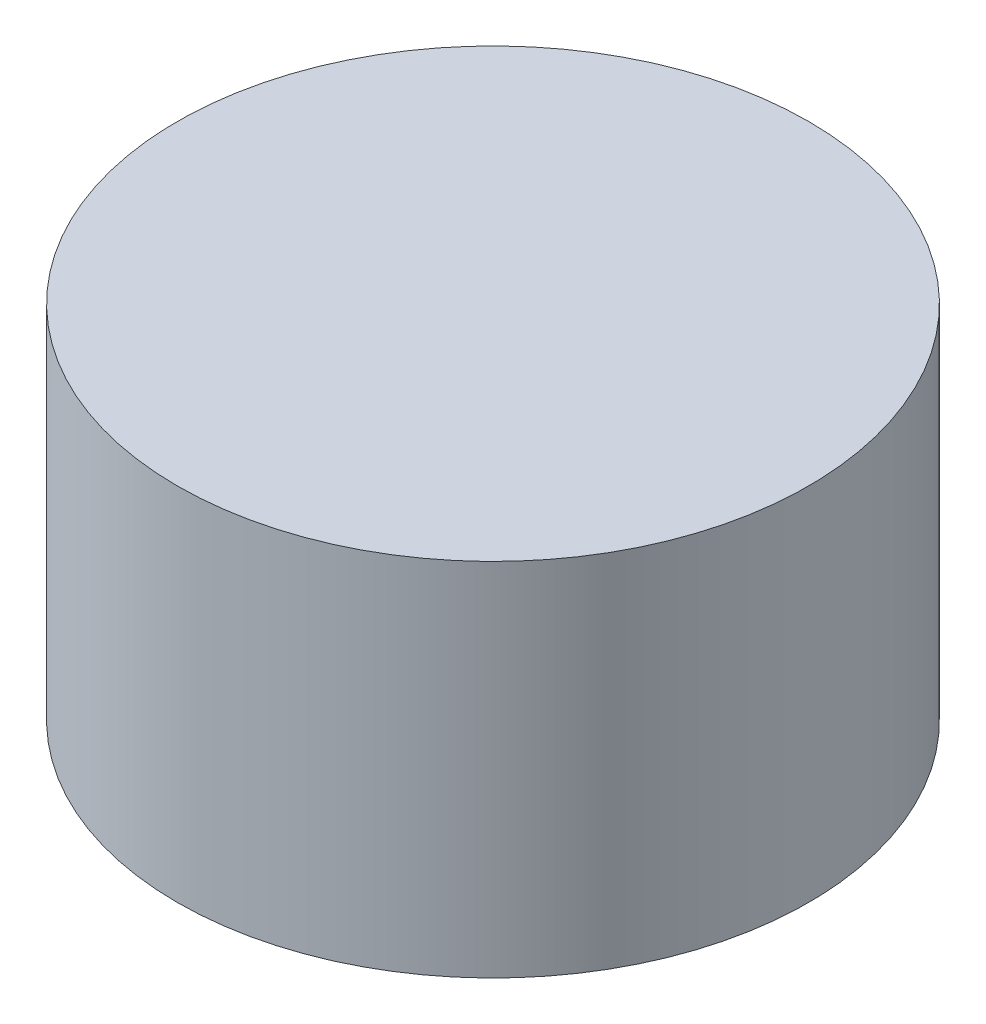
from build123d import *

# Parameters (mm, degrees)
SKETCH1_R           = 21
BOSS_EXTRUDE1_DEPTH = 24


with BuildPart() as part:
    # Sketch1 → Boss-Extrude1 (new body)
    with BuildSketch(Plane(origin=(0, 0, 0), x_dir=(1, 0, 0), z_dir=(0, 1, 0))):
        with Locations(Location((0, 0, 0), (0, 0, 270))):
            Circle(SKETCH1_R)
    extrude(amount=BOSS_EXTRUDE1_DEPTH)


solid = part.part
